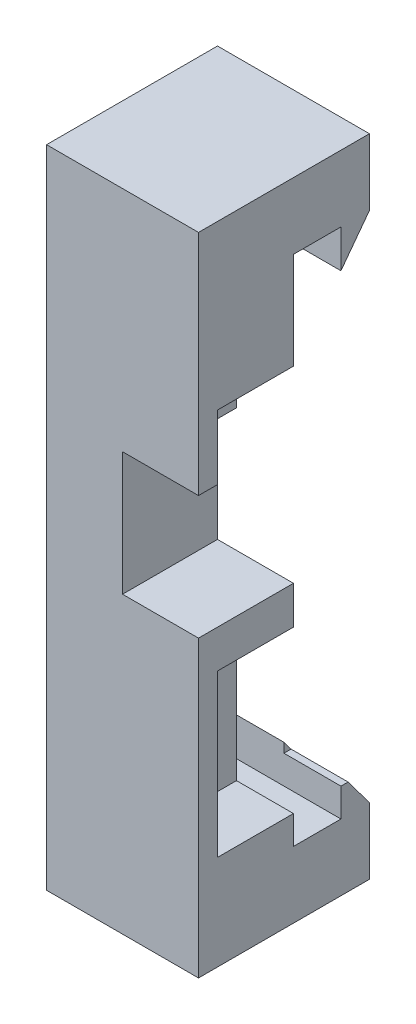
from build123d import *

# Parameters (mm, degrees)
SKETCH1_W           = 4
SKETCH1_H           = 17
BOSS_EXTRUDE1_DEPTH = 6
SKETCH2_W           = 2
SKETCH2_H           = 3.25
SKETCH2_W_2         = 1.5
SKETCH2_H_2         = 1.25
CUT_EXTRUDE1_DEPTH  = 19.466185313
CUT_EXTRUDE2_DEPTH  = 19.466185313
SKETCH4_W           = 2
SKETCH4_H           = 1.25
BOSS_EXTRUDE2_DEPTH = 2
BOSS_EXTRUDE3_DEPTH = 2
SKETCH6_W           = 1.5
SKETCH6_H           = 1.7
SKETCH6_H_2         = 4
CUT_EXTRUDE3_DEPTH  = 2
SKETCH7_W           = 4
SKETCH7_H           = 17
CUT_EXTRUDE4_DEPTH  = 10
SKETCH8_W           = 1.5
SKETCH8_H           = 1
BOSS_EXTRUDE4_DEPTH = 2


with BuildPart() as part:
    # Sketch1 → Boss-Extrude1 (new body)
    with BuildSketch(Plane.XY):
        with Locations((2, 8.5)):
            Rectangle(SKETCH1_W, SKETCH1_H)
    extrude(amount=BOSS_EXTRUDE1_DEPTH)

    # Sketch2 → Cut-Extrude1 (cut, through all)
    with BuildSketch(Plane.XY.offset(6)):
        with Locations((3, 9.375)):
            Rectangle(SKETCH2_W, SKETCH2_H)
        with Locations((3.25, 3.125)):
            Rectangle(SKETCH2_W_2, SKETCH2_H_2)
    extrude(amount=-CUT_EXTRUDE1_DEPTH, mode=Mode.SUBTRACT)

    # Sketch3 → Cut-Extrude2 (cut, through all)
    with BuildSketch(Plane.ZY):
        Polygon((0, 15.25), (0.75, 14.25), (0.75, 15.25), (2, 15.25), (2, 1.75), (0.75, 1.75), (0.75, 2.75), (0, 1.75), align=None)
    extrude(amount=-CUT_EXTRUDE2_DEPTH, mode=Mode.SUBTRACT)

    # Sketch4 → Boss-Extrude2 (add)
    with BuildSketch(Plane(origin=(4, 0, 0), x_dir=(0, 0, -1), z_dir=(1, 0, 0))):
        with Locations((-5, 3.125)):
            Rectangle(SKETCH4_W, SKETCH4_H)
    extrude(amount=-BOSS_EXTRUDE2_DEPTH)

    # Sketch5 → Boss-Extrude3 (add)
    with BuildSketch(Plane.XY.offset(6)):
        Polygon((0, 14.5), (2, 14.5), (2, 12.2), (4, 12.2), (4, 11), (2, 11), (2, 7.75), (4, 7.75), (4, 6.55), (2, 6.55), (2, 2.5), (0, 2.5), align=None)
    extrude(amount=BOSS_EXTRUDE3_DEPTH)

    # Sketch6 → Cut-Extrude3 (cut)
    with BuildSketch(Plane(origin=(0, 0, 2), x_dir=(-1, 0, 0), z_dir=(0, 0, -1))):
        with Locations((-3.25, 11.85)):
            Rectangle(SKETCH6_W, SKETCH6_H)
        with Locations((-3.25, 5.75)):
            Rectangle(SKETCH6_W, SKETCH6_H_2)
    extrude(amount=-CUT_EXTRUDE3_DEPTH, mode=Mode.SUBTRACT)

    # Sketch7 → Cut-Extrude4 (cut)
    with BuildSketch(Plane(origin=(4, 0, 0), x_dir=(0, 0, -1), z_dir=(1, 0, 0))):
        with Locations((-6.5, 8.5)):
            Rectangle(SKETCH7_W, SKETCH7_H)
    extrude(amount=-CUT_EXTRUDE4_DEPTH, mode=Mode.SUBTRACT)

    # Sketch8 → Boss-Extrude4 (add)
    with BuildSketch(Plane(origin=(0, 0, 4), x_dir=(-1, 0, 0), z_dir=(0, 0, -1))):
        with Locations((-3.25, 7.25)):
            Rectangle(SKETCH8_W, SKETCH8_H)
    extrude(amount=BOSS_EXTRUDE4_DEPTH)


solid = part.part
